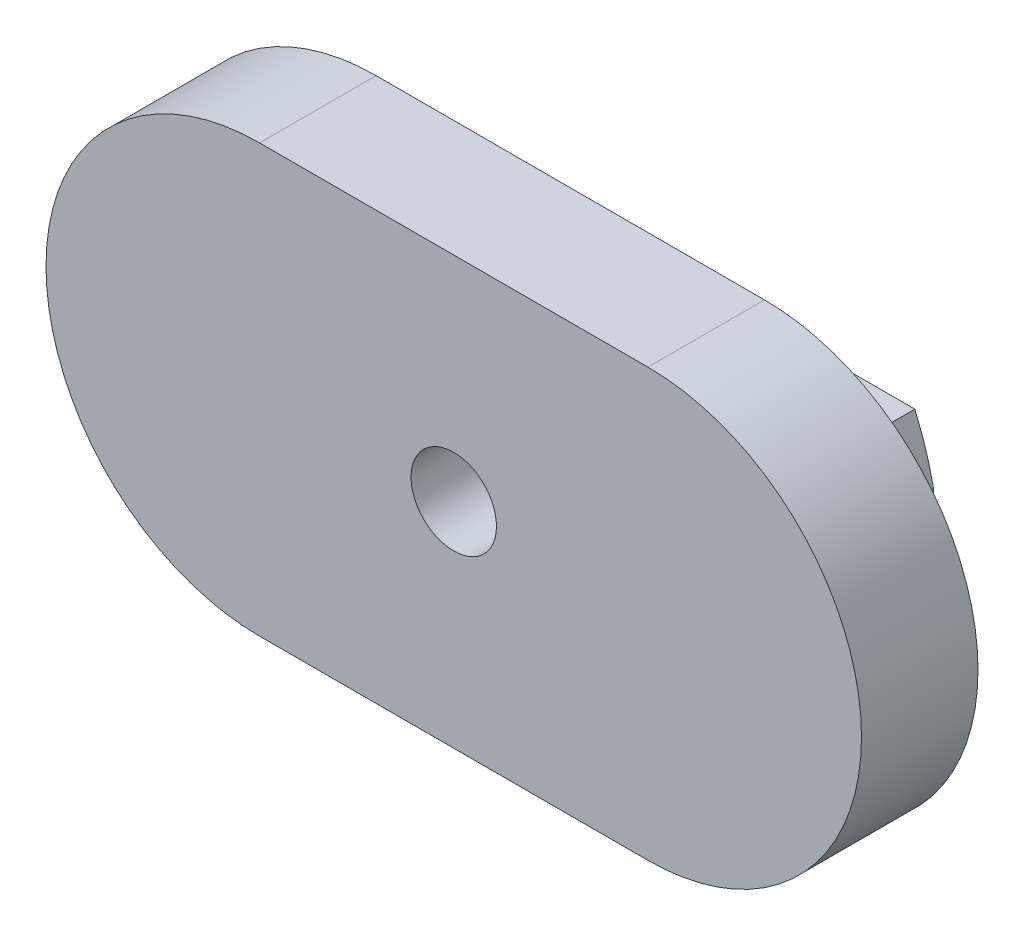
from build123d import *

# Parameters (mm, degrees)
SKETCH_1_R      = 1.1
EXTRUDE_1_DEPTH = 3
EXTRUDE_2_DEPTH = 2


with BuildPart() as part:
    # 草图1 → 凸台-拉伸1 (new body)
    with BuildSketch(Plane.XY):
        with BuildLine():
            Line((-5, 5.5), (5, 5.5))
            ThreePointArc((5, 5.5), (10.5, 0), (5, -5.5))
            Line((5, -5.5), (-5, -5.5))
            ThreePointArc((-5, -5.5), (-10.5, 0), (-5, 5.5))
        make_face()
        Circle(SKETCH_1_R, mode=Mode.SUBTRACT)
    extrude(amount=EXTRUDE_1_DEPTH)

    # 草图3 → 凸台-拉伸2 (add)
    with BuildSketch(Plane(origin=(0, 0, 0), x_dir=(-1, 0, 0), z_dir=(0, 0, -1))):
        with BuildLine():
            Line((-1.802775638, 3), (-6.873863542, 3))
            ThreePointArc((-6.873863542, 3), (-7.154882442, 2.248923573), (-7.354101966, 1.472135955))
            Line((-7.354101966, 1.472135955), (-7.354101966, 1))
            Line((-7.354101966, 1), (-3.354101966, 1))
            ThreePointArc((-3.354101966, 1), (-2.765564437, 2.145146462), (-1.802775638, 3))
        make_face()
        with BuildLine():
            Line((-7.354101966, -1.472135955), (-7.354101966, -1))
            Line((-7.354101966, -1), (-3.354101966, -1))
            ThreePointArc((-3.354101966, -1), (-2.765564437, -2.145146462), (-1.802775638, -3))
            Line((-1.802775638, -3), (-6.873863542, -3))
            ThreePointArc((-6.873863542, -3), (-7.154882442, -2.248923573), (-7.354101966, -1.472135955))
        make_face()
        with BuildLine():
            Line((1.802775638, -3), (6.873863542, -3))
            ThreePointArc((6.873863542, -3), (7.154882442, -2.248923573), (7.354101966, -1.472135955))
            Line((7.354101966, -1.472135955), (7.354101966, -1))
            Line((7.354101966, -1), (3.354101966, -1))
            ThreePointArc((3.354101966, -1), (2.765564437, -2.145146462), (1.802775638, -3))
        make_face()
        with BuildLine():
            Line((7.354101966, 1.472135955), (7.354101966, 1))
            Line((7.354101966, 1), (3.354101966, 1))
            ThreePointArc((3.354101966, 1), (2.765564437, 2.145146462), (1.802775638, 3))
            Line((1.802775638, 3), (6.873863542, 3))
            ThreePointArc((6.873863542, 3), (7.154882442, 2.248923573), (7.354101966, 1.472135955))
        make_face()
    extrude(amount=EXTRUDE_2_DEPTH)


solid = part.part
